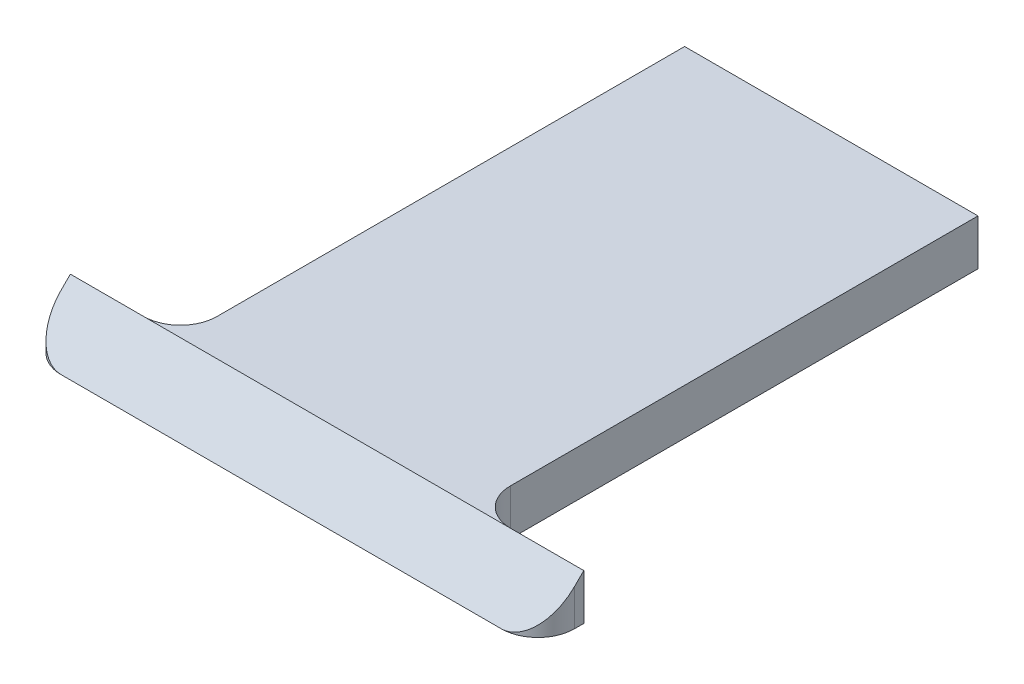
from build123d import *

# Parameters (mm, degrees)
BOSS_EXTRUDE1_DEPTH     = 12.5
FILLET1_R               = 10
CUT_EXTRUDE1_DEPTH      = 206.563250607
CUT_EXTRUDE1_DEPTH_BACK = 206.563250607
FILLET5_R               = 10


with BuildPart() as part:
    # Sketch1 → Boss-Extrude1 (new body)
    with BuildSketch(Plane(origin=(0, 0, 0), x_dir=(1, 0, 0), z_dir=(0, 1, 0))):
        Polygon((0, 0), (140, 0), (140, 12.5), (110, 12.5), (110, 150), (30, 150), (30, 12.5), (0, 12.5), align=None)
    extrude(amount=BOSS_EXTRUDE1_DEPTH)

    # Fillet1
    fillet1_edges = [part.edges().sort_by_distance(p)[0] for p in [
        (140, 6.25, 0),
        (0, 6.25, 0),
    ]]
    fillet(fillet1_edges, radius=FILLET1_R)

    # Sketch3 → Cut-Extrude1 (cut, two sides: drawn at the far end of the back side and taken through both)
    with BuildSketch(Plane(origin=(0, 0, 0), x_dir=(0, 0, -1), z_dir=(1, 0, 0)).offset(-CUT_EXTRUDE1_DEPTH_BACK)):
        Polygon((0, 0), (12.5, 12.5), (0, 12.5), align=None)
    extrude(amount=CUT_EXTRUDE1_DEPTH + CUT_EXTRUDE1_DEPTH_BACK, mode=Mode.SUBTRACT)

    # Fillet5
    fillet5_edges = [part.edges().sort_by_distance(p)[0] for p in [
        (30, 6.25, -12.5),
        (110, 6.25, -12.5),
    ]]
    fillet(fillet5_edges, radius=FILLET5_R)


solid = part.part
